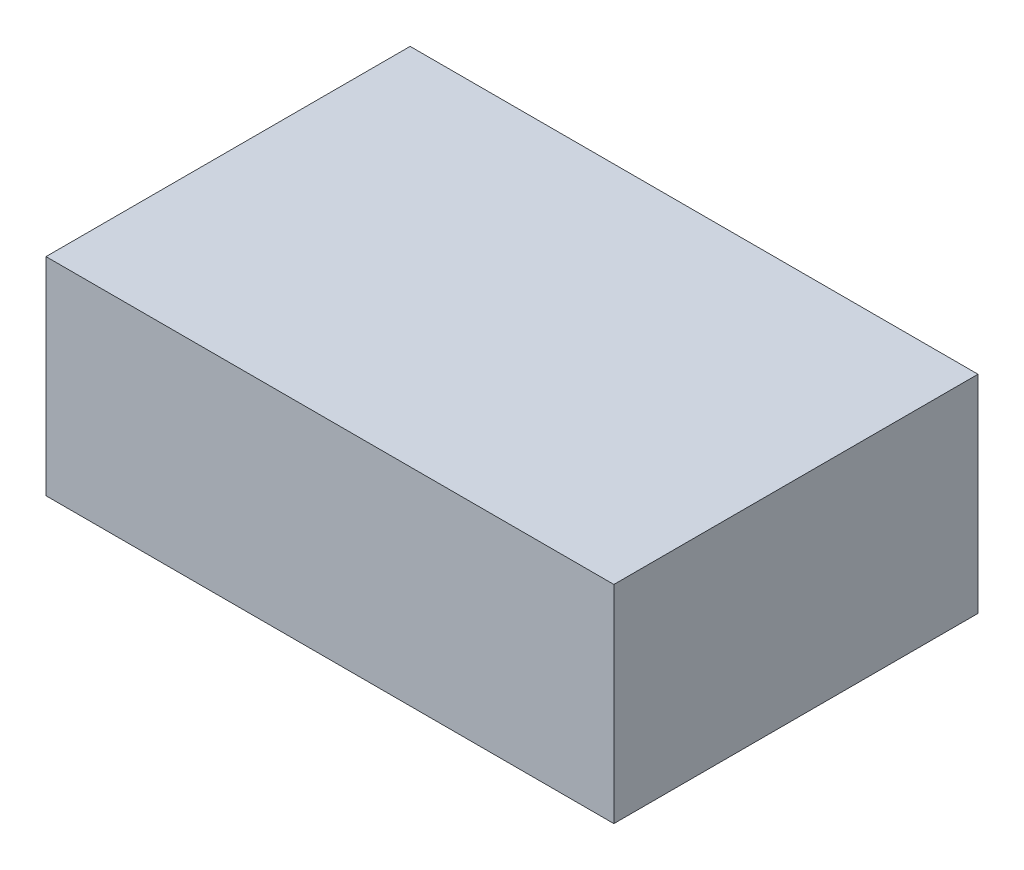
from build123d import *

# Parameters (mm, degrees)
ESQUISSE1_W        = 87.4
ESQUISSE1_H        = 56.04
BOSS_EXTRU_1_DEPTH = 31.88


with BuildPart() as part:
    # Esquisse1 → Boss.-Extru.1 (new body)
    with BuildSketch(Plane(origin=(0, 0, 0), x_dir=(1, 0, 0), z_dir=(0, 1, 0))):
        with Locations((43.7, 28.02)):
            Rectangle(ESQUISSE1_W, ESQUISSE1_H)
    extrude(amount=BOSS_EXTRU_1_DEPTH)


solid = part.part
